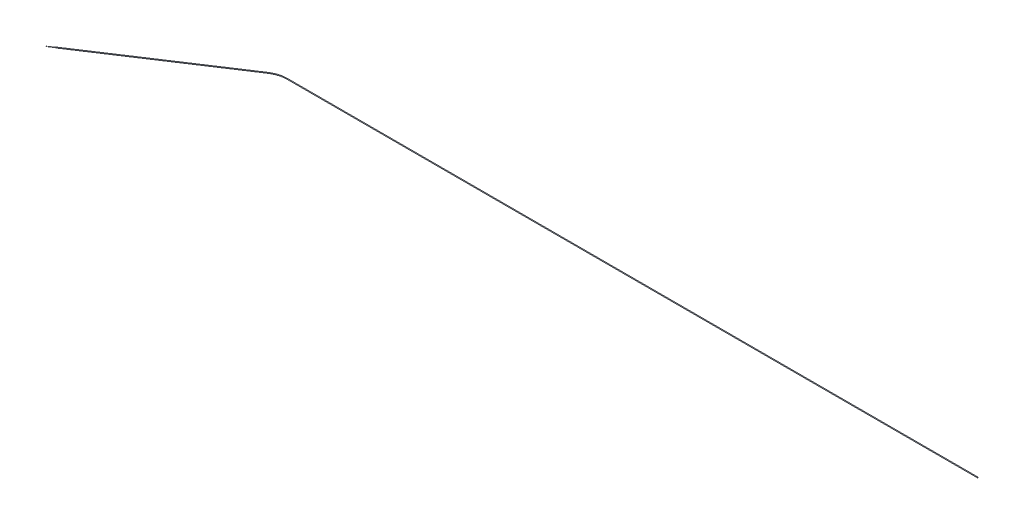
from build123d import *

# Parameters (mm, degrees)
SWEEP1_PROFILE_R    = 0.25
SKETCH6_R           = 0.1
BOSS_EXTRUDE1_DEPTH = 5


with BuildPart() as part:
    # Sweep1: sweep along a path in Sketch2
    with BuildLine(Plane(origin=(0, 0, 0), x_dir=(1, 0, 0), z_dir=(0, 1, 0))) as sweep1_path:
        Line((500, 20), (0, 20))
        ThreePointArc((0, 20), (-5.730491055, 19.161457989), (-10.98045636, 16.716147227))
        Line((-10.98045636, 16.716147227), (-103.755073472, -44.22538557))
    # Sweep1 profile (on start of the path) → Sweep1 (sweep)
    with BuildSketch(Plane(origin=(500, 0, -20), x_dir=(0, 0, -1), z_dir=(-1, 0, 0))):
        Circle(SWEEP1_PROFILE_R)
    sweep(path=sweep1_path.line)

    # Sketch6 → Boss-Extrude1 (add)
    with BuildSketch(Plane(origin=(-92.774617112, 0, 60.941532798), x_dir=(0.5490228179981329, 0, 0.8358073613682695), z_dir=(-0.8358073613682695, 0, 0.5490228179981329))):
        with Locations((-20, 0)):
            Circle(SKETCH6_R)
    extrude(amount=BOSS_EXTRUDE1_DEPTH)


solid = part.part
